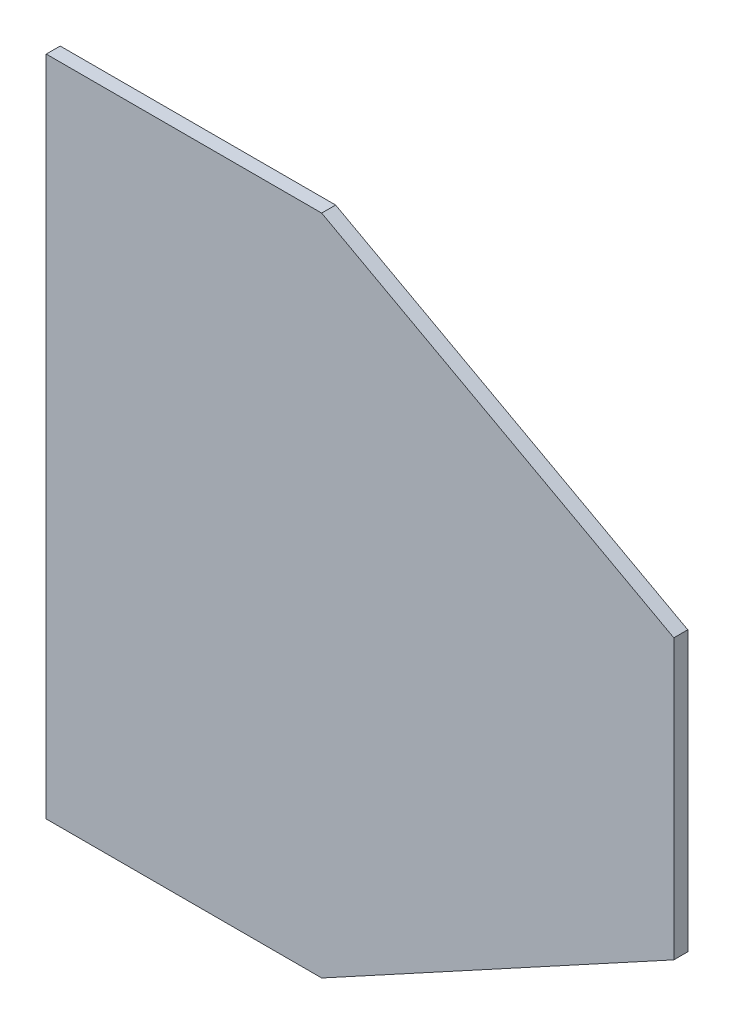
from build123d import *

# Parameters (mm, degrees)
BOSS_EXTRUDE1_DEPTH = 4


with BuildPart() as part:
    # Sketch1 → Boss-Extrude1 (new body)
    with BuildSketch(Plane.XY):
        Polygon((35, -64), (-43.999999997, -64), (-43.999999997, 126), (35, 126), (136.000000003, 71), (136.000000003, -9), align=None)
    extrude(amount=BOSS_EXTRUDE1_DEPTH)


solid = part.part
